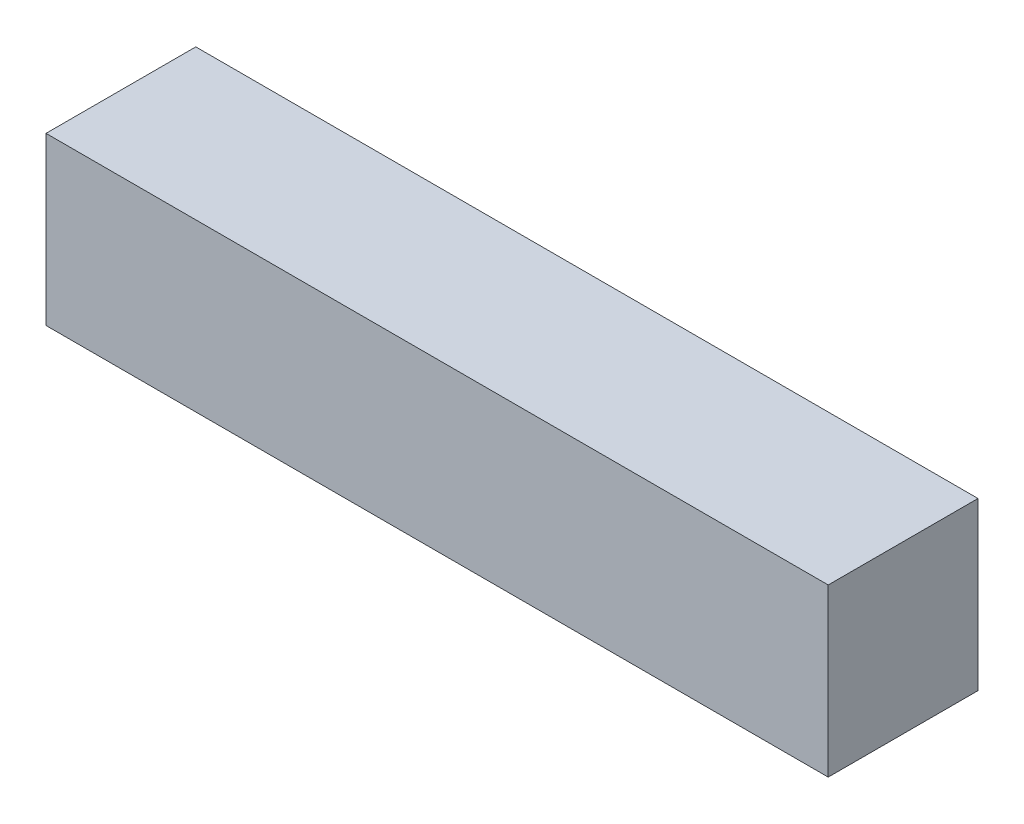
from build123d import *

# Parameters (mm, degrees)
SKETCH1_W           = 47
SKETCH1_H           = 9
BOSS_EXTRUDE1_DEPTH = 10


with BuildPart() as part:
    # Sketch1 → Boss-Extrude1 (new body)
    with BuildSketch(Plane(origin=(0, 0, 0), x_dir=(1, 0, 0), z_dir=(0, 1, 0))):
        with Locations((23.5, 4.5)):
            Rectangle(SKETCH1_W, SKETCH1_H)
    extrude(amount=BOSS_EXTRUDE1_DEPTH)


solid = part.part
